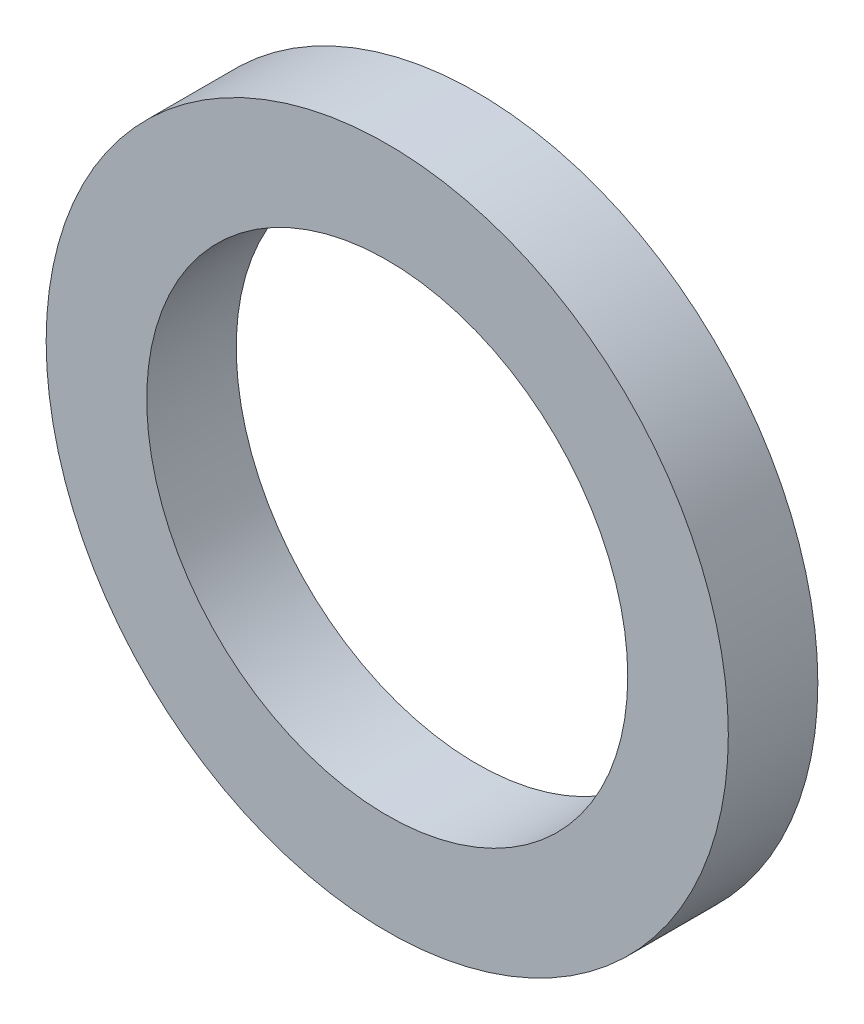
from build123d import *

# Parameters (mm, degrees)
CROQUIS1_R              = 11.43
CROQUIS1_R_2            = 8.06
SALIENTE_EXTRUIR1_DEPTH = 1.5


with BuildPart() as part:
    # Croquis1 → Saliente-Extruir1 (new, symmetric)
    with BuildSketch(Plane.XY):
        Circle(CROQUIS1_R)
        Circle(CROQUIS1_R_2, mode=Mode.SUBTRACT)
    extrude(amount=SALIENTE_EXTRUIR1_DEPTH, both=True)


solid = part.part
